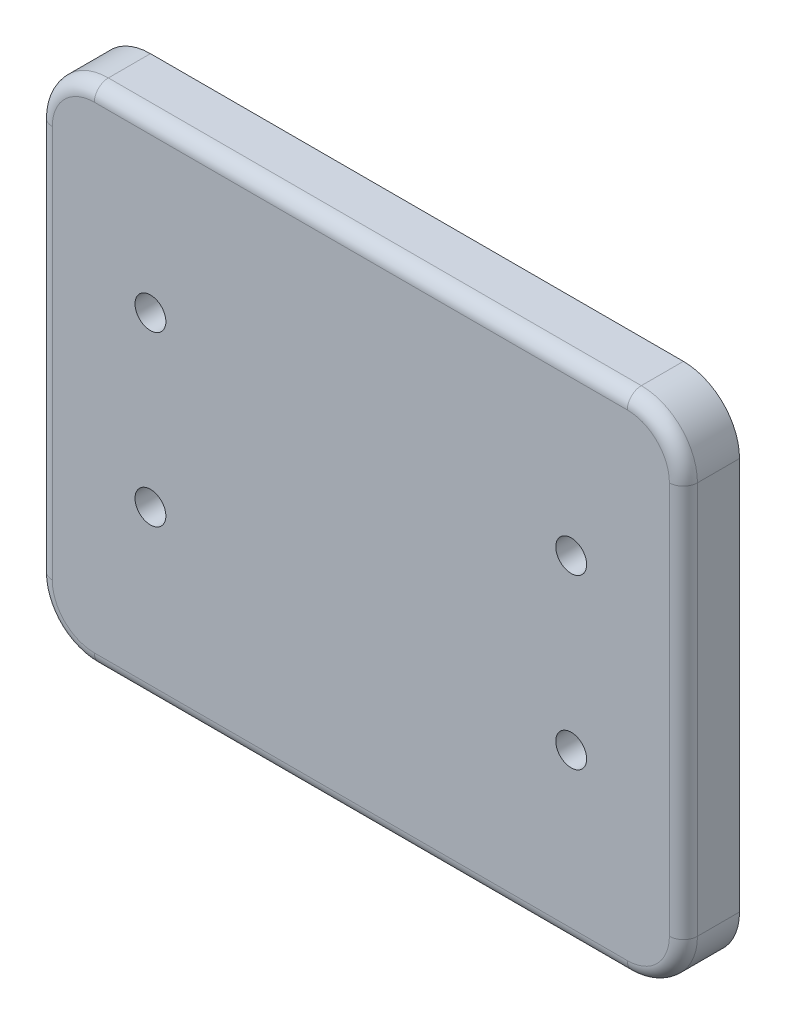
from build123d import *

# Parameters (mm, degrees)
BOSS_EXTRUDE1_DEPTH = 20
FILLET1_R           = 5
SKETCH2_R           = 5.5
CUT_EXTRUDE1_DEPTH  = 148.39402973
SKETCH3_R           = 9
CUT_EXTRUDE2_DEPTH  = 11


with BuildPart() as part:
    # Sketch1 → Boss-Extrude1 (new body)
    with BuildSketch(Plane.XY):
        with BuildLine():
            Line((95, 90), (-95, 90))
            ThreePointArc((-95, 90), (-109.142135624, 84.142135624), (-115, 70))
            Line((-115, 70), (-115, -70))
            ThreePointArc((-115, -70), (-109.142135624, -84.142135624), (-95, -90))
            Line((-95, -90), (95, -90))
            ThreePointArc((95, -90), (109.142135624, -84.142135624), (115, -70))
            Line((115, -70), (115, 70))
            ThreePointArc((115, 70), (109.142135624, 84.142135624), (95, 90))
        make_face()
    extrude(amount=BOSS_EXTRUDE1_DEPTH)

    # Fillet1
    fillet1_edges = [part.edges().sort_by_distance(p)[0] for p in [
        (-109.142135624, -84.142135624, 20),
        (0, -90, 20),
        (109.142135624, -84.142135624, 20),
        (115, 0, 20),
        (109.142135624, 84.142135624, 20),
        (0, 90, 20),
        (-109.142135624, 84.142135624, 20),
        (-115, 0, 20),
    ]]
    fillet(fillet1_edges, radius=FILLET1_R)

    # Sketch2 → Cut-Extrude1 (cut, through all)
    with BuildSketch(Plane.XY.offset(20)):
        with Locations((-75, 30)):
            Circle(SKETCH2_R)
        with Locations((75, 30)):
            Circle(SKETCH2_R)
    cut_extrude1 = extrude(amount=-CUT_EXTRUDE1_DEPTH, mode=Mode.SUBTRACT)

    # Sketch3 → Cut-Extrude2 (cut)
    with BuildSketch(Plane(origin=(0, 0, 0), x_dir=(-1, 0, 0), z_dir=(0, 0, -1))):
        with Locations((-75, 30)):
            Circle(SKETCH3_R)
        with Locations((75, 30)):
            Circle(SKETCH3_R)
    cut_extrude2 = extrude(amount=-CUT_EXTRUDE2_DEPTH, mode=Mode.SUBTRACT)

    # Mirror1: Cut-Extrude1, Cut-Extrude2 across plane
    add(cut_extrude1.mirror(Plane.ZX), mode=Mode.SUBTRACT)
    add(cut_extrude2.mirror(Plane.ZX), mode=Mode.SUBTRACT)


solid = part.part
